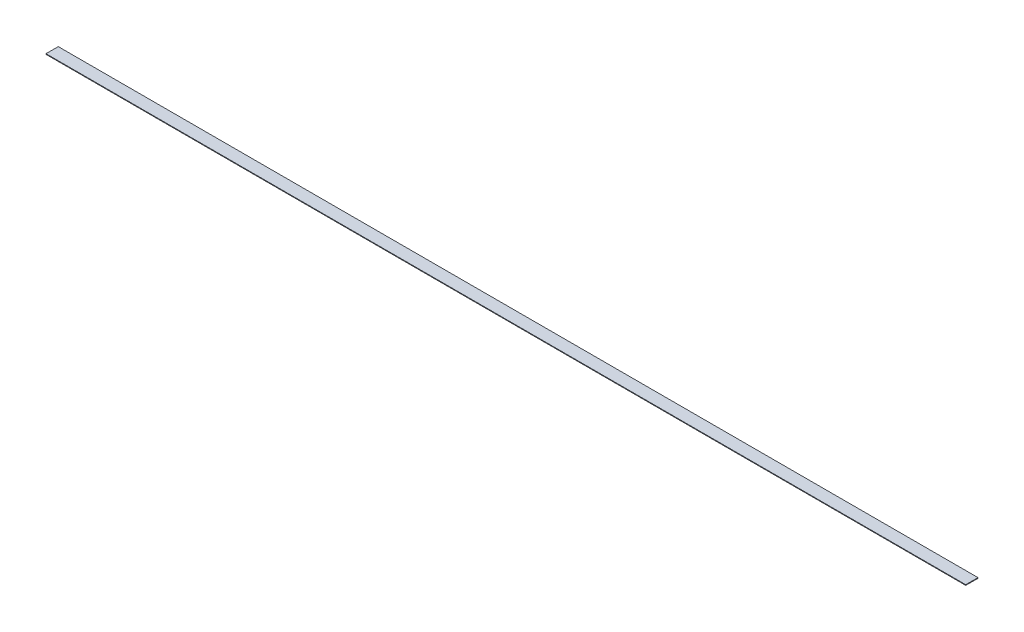
from build123d import *

# Parameters (mm, degrees)
SKETCH_1_W      = 3000
SKETCH_1_H      = 40
EXTRUDE_1_DEPTH = 2


with BuildPart() as part:
    # Эскиз1 → Бобышка-Вытянуть1 (new body)
    with BuildSketch(Plane(origin=(0, 0, 0), x_dir=(1, 0, 0), z_dir=(0, 1, 0))):
        Rectangle(SKETCH_1_W, SKETCH_1_H)
    extrude(amount=EXTRUDE_1_DEPTH)


solid = part.part
